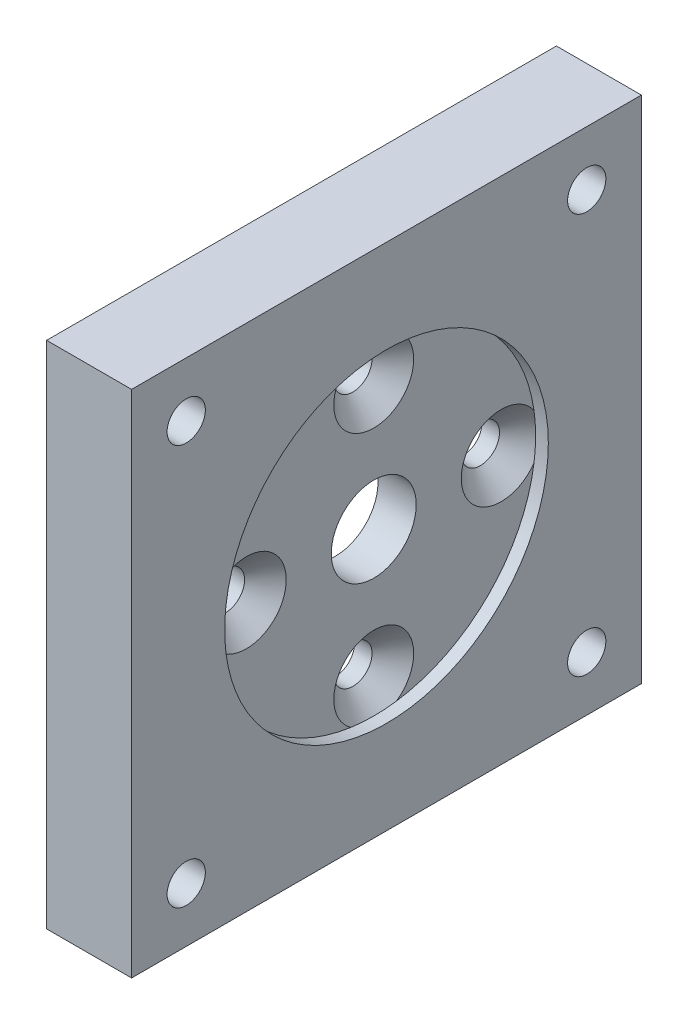
from build123d import *

# Parameters (mm, degrees)
SKETCH1_W                                      = 60
SKETCH1_H                                      = 60
EXTRUDE1_DEPTH                                 = 10
SKETCH3_R                                      = 5
EXTRUDE2_DEPTH                                 = 44.588989435
SKETCH5_R                                      = 19.05
EXTRUDE3_DEPTH                                 = 1.5
SKETCH6_R                                      = 22.4
EXTRUDE4_DEPTH                                 = 4
SKETCH7_R                                      = 2.25
EXTRUDE6_DEPTH                                 = 44.588989435
SKETCH8_R                                      = 2.25
EXTRUDE7_DEPTH                                 = 44.269504273
CSK_FOR_M4_FLAT_HEAD_MACHINE_SCREW1_AT_2_COUNT = 2
CSK_FOR_M4_FLAT_HEAD_MACHINE_SCREW1_AT_2_PITCH = 21.213203436
CSK_FOR_M4_FLAT_HEAD_MACHINE_SCREW1_AT_3_COUNT = 2
CSK_FOR_M4_FLAT_HEAD_MACHINE_SCREW1_AT_3_PITCH = 30
CSK_FOR_M4_FLAT_HEAD_MACHINE_SCREW1_AT_4_COUNT = 2
CSK_FOR_M4_FLAT_HEAD_MACHINE_SCREW1_AT_4_PITCH = 21.213203436


with BuildPart() as part:
    # Sketch1 → Extrude1 (new body)
    with BuildSketch(Plane(origin=(0, 0, 0), x_dir=(0, 0, -1), z_dir=(1, 0, 0))):
        Rectangle(SKETCH1_W, SKETCH1_H)
    extrude(amount=EXTRUDE1_DEPTH)

    # Sketch3 → Extrude2 (cut, through all)
    with BuildSketch(Plane(origin=(10, 0, 0), x_dir=(0, 0, -1), z_dir=(1, 0, 0))):
        Circle(SKETCH3_R)
    extrude(amount=-EXTRUDE2_DEPTH, mode=Mode.SUBTRACT)

    # Sketch5 → Extrude3 (cut)
    with BuildSketch(Plane(origin=(10, 0, 0), x_dir=(0, 0, -1), z_dir=(1, 0, 0))):
        Circle(SKETCH5_R)
    extrude(amount=-EXTRUDE3_DEPTH, mode=Mode.SUBTRACT)

    # Sketch6 → Extrude4 (cut)
    with BuildSketch(Plane.ZY):
        Circle(SKETCH6_R)
    extrude(amount=-EXTRUDE4_DEPTH, mode=Mode.SUBTRACT)

    # Sketch7 → Extrude6 (cut, through all)
    with BuildSketch(Plane.ZY):
        with Locations((23.57, 23.57)):
            Circle(SKETCH7_R)
        with Locations((-23.57, 23.57)):
            Circle(SKETCH7_R)
        with Locations((23.57, -23.57)):
            Circle(SKETCH7_R)
        with Locations((-23.57, -23.57)):
            Circle(SKETCH7_R)
    extrude(amount=-EXTRUDE6_DEPTH, mode=Mode.SUBTRACT)

    # Sketch8 → Extrude7 (cut, through all)
    with BuildSketch(Plane(origin=(8.5, 0, 0), x_dir=(0, 0, -1), z_dir=(1, 0, 0))):
        with Locations((0, 15)):
            Circle(SKETCH8_R)
        with Locations((-15, 0)):
            Circle(SKETCH8_R)
        with Locations((0, -15)):
            Circle(SKETCH8_R)
        with Locations((15, 0)):
            Circle(SKETCH8_R)
    extrude(amount=-EXTRUDE7_DEPTH, mode=Mode.SUBTRACT)

    # Sketch9 → CSK for M4 Flat Head Machine Screw1 (revolve, cut)
    with BuildSketch(Plane(origin=(8.5, 15, 0), x_dir=(0, 0, -1), z_dir=(0, 1, 0))):
        Polygon((0, 0), (0, 8.5), (2.25, 8.5), (2.25, 2.45), (4.7, 0), align=None)
    csk_for_m4_flat_head_machine_screw1 = revolve(axis=Axis((14.85, 15, 0), (-1, 0, 0)), mode=Mode.SUBTRACT)

    # CSK for M4 Flat Head Machine Screw1 at 2: CSK for M4 Flat Head Machine Screw1 ×2
    with Locations(*[Vector(0, -0.7071067811865476, 0.7071067811865476) * (i * CSK_FOR_M4_FLAT_HEAD_MACHINE_SCREW1_AT_2_PITCH) for i in range(1, CSK_FOR_M4_FLAT_HEAD_MACHINE_SCREW1_AT_2_COUNT)]):
        add(csk_for_m4_flat_head_machine_screw1, mode=Mode.SUBTRACT)

    # CSK for M4 Flat Head Machine Screw1 at 3: CSK for M4 Flat Head Machine Screw1 ×2
    with Locations(*[(0, -i * CSK_FOR_M4_FLAT_HEAD_MACHINE_SCREW1_AT_3_PITCH, 0) for i in range(1, CSK_FOR_M4_FLAT_HEAD_MACHINE_SCREW1_AT_3_COUNT)]):
        add(csk_for_m4_flat_head_machine_screw1, mode=Mode.SUBTRACT)

    # CSK for M4 Flat Head Machine Screw1 at 4: CSK for M4 Flat Head Machine Screw1 ×2
    with Locations(*[Vector(0, -0.7071067811865476, -0.7071067811865476) * (i * CSK_FOR_M4_FLAT_HEAD_MACHINE_SCREW1_AT_4_PITCH) for i in range(1, CSK_FOR_M4_FLAT_HEAD_MACHINE_SCREW1_AT_4_COUNT)]):
        add(csk_for_m4_flat_head_machine_screw1, mode=Mode.SUBTRACT)


solid = part.part
